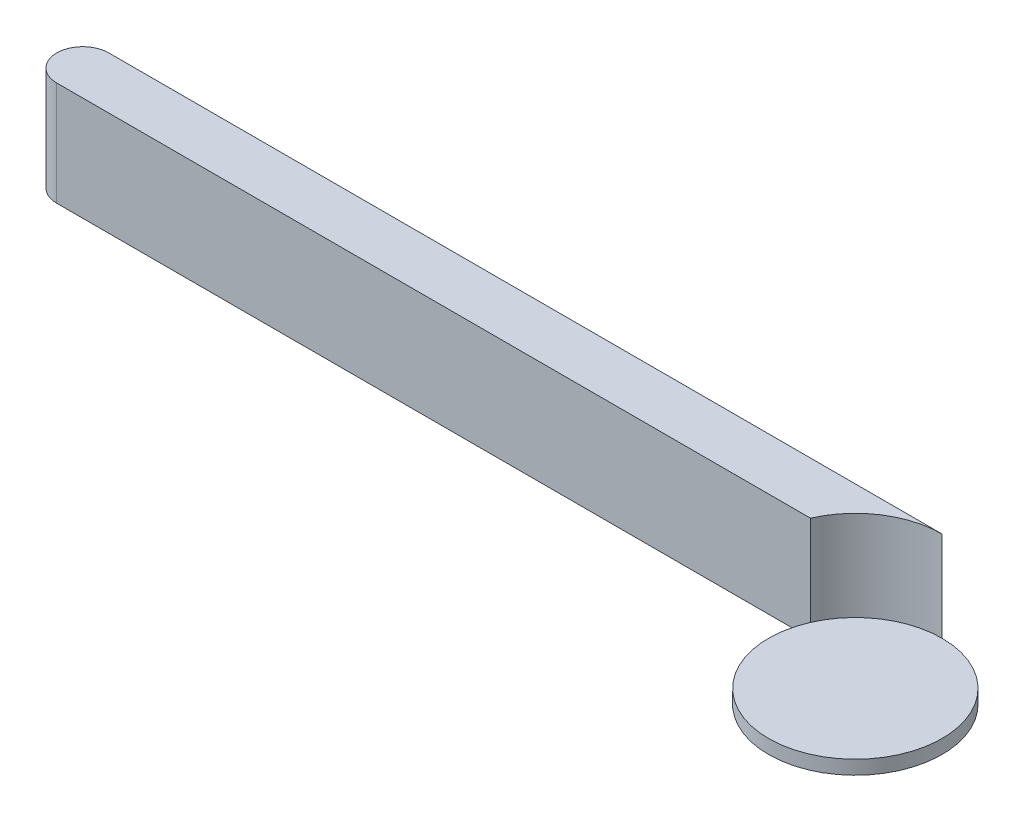
from build123d import *

# Parameters (mm, degrees)
BOSS_EXTRUDE1_DEPTH = 19.05
CUT_EXTRUDE1_START  = -16.51
SKETCH2_R           = 15.875
CUT_EXTRUDE1_DEPTH  = 16.51


with BuildPart() as part:
    # Sketch1 → Boss-Extrude1 (new body)
    with BuildSketch(Plane(origin=(0, 0, 0), x_dir=(1, 0, 0), z_dir=(0, 1, 0))):
        with BuildLine():
            Line((0, -4.7625), (137.850322169, -4.7625))
            ThreePointArc((137.850322169, -4.7625), (161.0950956, -24.394477921), (152.4, 4.7625))
            Line((152.4, 4.7625), (0, 4.7625))
            ThreePointArc((0, 4.7625), (-4.7625, 0), (0, -4.7625))
        make_face()
    extrude(amount=BOSS_EXTRUDE1_DEPTH)

    # Sketch2 → Cut-Extrude1 (cut)
    with BuildSketch(Plane(origin=(0, 19.05, 0), x_dir=(1, 0, 0), z_dir=(0, 1, 0)).offset(CUT_EXTRUDE1_START)):
        with Locations((152.4, -11.1125)):
            Circle(SKETCH2_R)
    extrude(amount=CUT_EXTRUDE1_DEPTH, mode=Mode.SUBTRACT)


solid = part.part
